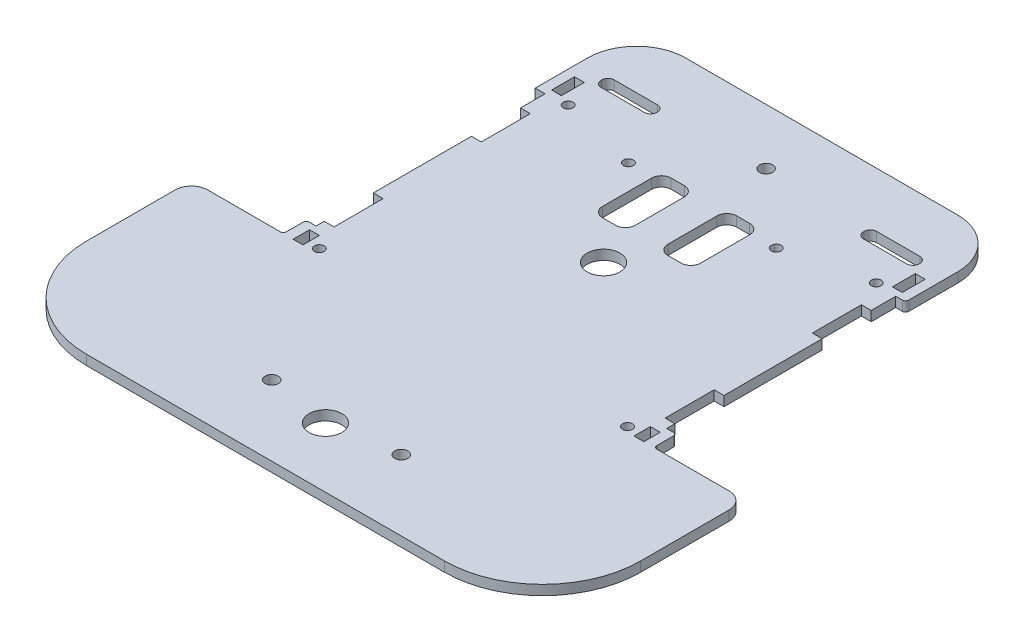
from build123d import *

# Parameters (mm, degrees)
SKETCH1_R           = 2
SKETCH1_R_2         = 1.5
SKETCH1_W           = 3
SKETCH1_H           = 5
SKETCH1_R_3         = 5
SKETCH1_H_2         = 7
BOSS_EXTRUDE1_DEPTH = 3


with BuildPart() as part:
    # Sketch1 → Boss-Extrude1 (new body)
    with BuildSketch(Plane(origin=(0, 0, 0), x_dir=(1, 0, 0), z_dir=(0, 1, 0))):
        with BuildLine():
            ThreePointArc((10.699698215, 29.641238244), (11.406804996, 29.934131463), (11.699698215, 30.641238244))
            Line((11.699698215, 30.641238244), (11.699698215, 38.128019164))
            Line((11.699698215, 38.128019164), (11.699698215, 45.611855364))
            ThreePointArc((11.699698215, 45.611855364), (7.306299933, 56.218457082), (-3.300301785, 60.611855364))
            Line((-3.300301785, 60.611855364), (-86.492412558, 60.611855364))
            ThreePointArc((-86.492412558, 60.611855364), (-97.099014275, 56.218457082), (-101.492412558, 45.611855364))
            Line((-101.492412558, 45.611855364), (-101.492412558, 38.128019164))
            Line((-101.492412558, 38.128019164), (-101.492412558, 29.641238244))
            Line((-101.492412558, 29.641238244), (-98.492412558, 29.641238244))
            Line((-98.492412558, 29.641238244), (-98.492412558, 22.141238244))
            Line((-98.492412558, 22.141238244), (-95.492412558, 22.141238244))
            Line((-95.492412558, 22.141238244), (-95.492412558, 7.141238244))
            Line((-95.492412558, 7.141238244), (-98.492412558, 7.141238244))
            Line((-98.492412558, 7.141238244), (-98.492412558, -22.858761756))
            Line((-98.492412558, -22.858761756), (-95.492412558, -22.858761756))
            Line((-95.492412558, -22.858761756), (-95.492412558, -37.858761756))
            Line((-95.492412558, -37.858761756), (-98.492412558, -37.858761756))
            Line((-98.492412558, -37.858761756), (-98.492412558, -40.358761756))
            Line((-98.492412558, -40.358761756), (-100.492412558, -40.358761756))
            ThreePointArc((-100.492412558, -40.358761756), (-101.199519339, -40.651654975), (-101.492412558, -41.358761756))
            Line((-101.492412558, -41.358761756), (-101.492412558, -46.358761756))
            ThreePointArc((-101.492412558, -46.358761756), (-101.785305776, -47.065868537), (-102.492412558, -47.358761756))
            Line((-102.492412558, -47.358761756), (-124.579684665, -47.358761756))
            ThreePointArc((-124.579684665, -47.358761756), (-128.115218571, -48.82322785), (-129.579684665, -52.358761756))
            Line((-129.579684665, -52.358761756), (-129.579684665, -79.388144636))
            ThreePointArc((-129.579684665, -79.388144636), (-120.7928881, -100.601348072), (-99.579684665, -109.388144636))
            Line((-99.579684665, -109.388144636), (9.786970322, -109.388144636))
            ThreePointArc((9.786970322, -109.388144636), (31.000173758, -100.601348072), (39.786970322, -79.388144636))
            Line((39.786970322, -79.388144636), (39.786970322, -52.358761756))
            ThreePointArc((39.786970322, -52.358761756), (38.322504228, -48.82322785), (34.786970322, -47.358761756))
            Line((34.786970322, -47.358761756), (12.699698215, -47.358761756))
            ThreePointArc((12.699698215, -47.358761756), (11.992591434, -47.065868537), (11.699698215, -46.358761756))
            Line((11.699698215, -46.358761756), (11.699698215, -41.358761756))
            ThreePointArc((11.699698215, -41.358761756), (11.406804997, -40.651654975), (10.699698215, -40.358761756))
            Line((10.699698215, -40.358761756), (8.699698215, -40.358761756))
            Line((8.699698215, -40.358761756), (8.699698215, -37.858761756))
            Line((8.699698215, -37.858761756), (5.699698215, -37.858761756))
            Line((5.699698215, -37.858761756), (5.699698215, -22.858761756))
            Line((5.699698215, -22.858761756), (8.699698215, -22.858761756))
            Line((8.699698215, -22.858761756), (8.699698215, 7.141238244))
            Line((8.699698215, 7.141238244), (5.699698215, 7.141238244))
            Line((5.699698215, 7.141238244), (5.699698215, 22.141238244))
            Line((5.699698215, 22.141238244), (8.699698215, 22.141238244))
            Line((8.699698215, 22.141238244), (8.699698215, 29.641238244))
            Line((8.699698215, 29.641238244), (10.699698215, 29.641238244))
        make_face()
        with Locations(Location((-64.542412558, -87.858761756, 0), (0, 0, 270))):
            Circle(SKETCH1_R, mode=Mode.SUBTRACT)
        with Locations(Location((-91.992412558, -45.858761756, 0), (0, 0, 270))):
            Circle(SKETCH1_R_2, mode=Mode.SUBTRACT)
        with Locations((-96.992412558, -44.858761756)):
            Rectangle(SKETCH1_W, SKETCH1_H, mode=Mode.SUBTRACT)
        with Locations(Location((-44.896357171, -91.07147213, 0), (0, 0, 270))):
            Circle(SKETCH1_R_3, mode=Mode.SUBTRACT)
        with Locations(Location((-24.942412558, -87.858761756, 0), (0, 0, 270))):
            Circle(SKETCH1_R, mode=Mode.SUBTRACT)
        with Locations(Location((2.199698215, -45.858761756, 0), (0, 0, 270))):
            Circle(SKETCH1_R_2, mode=Mode.SUBTRACT)
        with Locations((7.199698215, -44.858761756)):
            Rectangle(SKETCH1_W, SKETCH1_H, mode=Mode.SUBTRACT)
        with BuildLine():
            Line((-52.896357171, 5.611855364), (-56.896357171, 5.611855364))
            ThreePointArc((-56.896357171, 5.611855364), (-59.017677515, 6.49053502), (-59.896357171, 8.611855364))
            Line((-59.896357171, 8.611855364), (-59.896357171, 23.611855364))
            ThreePointArc((-59.896357171, 23.611855364), (-59.017677515, 25.733175707), (-56.896357171, 26.611855364))
            Line((-56.896357171, 26.611855364), (-52.896357171, 26.611855364))
            ThreePointArc((-52.896357171, 26.611855364), (-50.775036828, 25.733175707), (-49.896357171, 23.611855364))
            Line((-49.896357171, 23.611855364), (-49.896357171, 8.611855364))
            ThreePointArc((-49.896357171, 8.611855364), (-50.775036828, 6.49053502), (-52.896357171, 5.611855364))
        make_face(mode=Mode.SUBTRACT)
        with Locations(Location((-91.992412558, 30.187503495, 0), (0, 0, 270))):
            Circle(SKETCH1_R_2, mode=Mode.SUBTRACT)
        with Locations((-96.992412558, 35.141238244)):
            Rectangle(SKETCH1_W, SKETCH1_H_2, mode=Mode.SUBTRACT)
        with Locations(Location((-67.492412558, 24.11185536, 0), (0, 0, 270))):
            Circle(SKETCH1_R_2, mode=Mode.SUBTRACT)
        with BuildLine():
            Line((-78.392412558, 39.891238244), (-91.592412558, 39.891238244))
            ThreePointArc((-91.592412558, 39.891238244), (-92.935915442, 40.44773536), (-93.492412558, 41.791238244))
            Line((-93.492412558, 41.791238244), (-93.492412558, 41.991238244))
            ThreePointArc((-93.492412558, 41.991238244), (-92.935915442, 43.334741128), (-91.592412558, 43.891238244))
            Line((-91.592412558, 43.891238244), (-78.392412558, 43.891238244))
            ThreePointArc((-78.392412558, 43.891238244), (-77.048909673, 43.334741128), (-76.492412558, 41.991238244))
            Line((-76.492412558, 41.991238244), (-76.492412558, 41.791238244))
            ThreePointArc((-76.492412558, 41.791238244), (-77.048909673, 40.44773536), (-78.392412558, 39.891238244))
        make_face(mode=Mode.SUBTRACT)
        with Locations(Location((-44.896357171, -6.07147213, 0), (0, 0, 270))):
            Circle(SKETCH1_R_3, mode=Mode.SUBTRACT)
        with BuildLine():
            ThreePointArc((-32.896357171, 26.611855364), (-30.775036828, 25.733175707), (-29.896357171, 23.611855364))
            Line((-29.896357171, 23.611855364), (-29.896357171, 8.611855364))
            ThreePointArc((-29.896357171, 8.611855364), (-30.775036828, 6.49053502), (-32.896357171, 5.611855364))
            Line((-32.896357171, 5.611855364), (-36.896357171, 5.611855364))
            ThreePointArc((-36.896357171, 5.611855364), (-39.017677515, 6.49053502), (-39.896357171, 8.611855364))
            Line((-39.896357171, 8.611855364), (-39.896357171, 23.611855364))
            ThreePointArc((-39.896357171, 23.611855364), (-39.017677515, 25.733175707), (-36.896357171, 26.611855364))
            Line((-36.896357171, 26.611855364), (-32.896357171, 26.611855364))
        make_face(mode=Mode.SUBTRACT)
        with Locations(Location((-22.300301785, 24.11185536, 0), (0, 0, 270))):
            Circle(SKETCH1_R_2, mode=Mode.SUBTRACT)
        with Locations(Location((-44.896357171, 43.611855364, 0), (0, 0, 270))):
            Circle(SKETCH1_R, mode=Mode.SUBTRACT)
        with BuildLine():
            Line((3.699698215, 41.991238244), (3.699698215, 41.791238244))
            ThreePointArc((3.699698215, 41.791238244), (3.143201099, 40.44773536), (1.799698215, 39.891238244))
            Line((1.799698215, 39.891238244), (-11.400301785, 39.891238244))
            ThreePointArc((-11.400301785, 39.891238244), (-12.743804669, 40.44773536), (-13.300301785, 41.791238244))
            Line((-13.300301785, 41.791238244), (-13.300301785, 41.991238244))
            ThreePointArc((-13.300301785, 41.991238244), (-12.743804669, 43.334741128), (-11.400301785, 43.891238244))
            Line((-11.400301785, 43.891238244), (1.799698215, 43.891238244))
            ThreePointArc((1.799698215, 43.891238244), (3.143201099, 43.334741128), (3.699698215, 41.991238244))
        make_face(mode=Mode.SUBTRACT)
        with Locations(Location((2.199698215, 30.187503495, 0), (0, 0, 270))):
            Circle(SKETCH1_R_2, mode=Mode.SUBTRACT)
        with Locations((7.199698215, 35.141238244)):
            Rectangle(SKETCH1_W, SKETCH1_H_2, mode=Mode.SUBTRACT)
    extrude(amount=BOSS_EXTRUDE1_DEPTH)


solid = part.part
